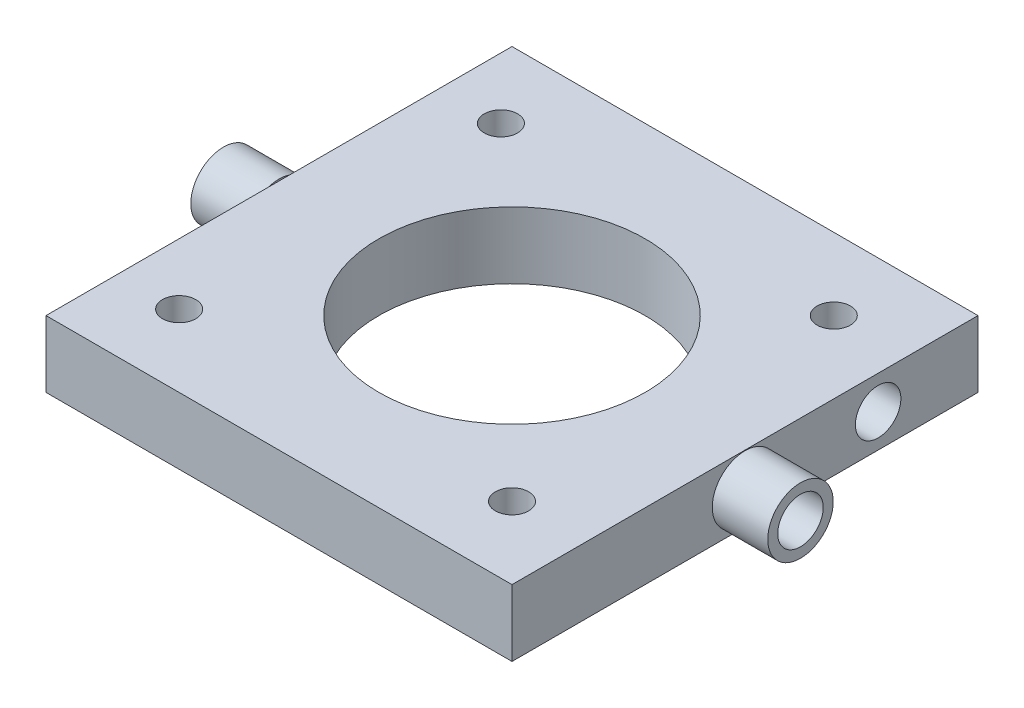
from build123d import *

# Parameters (mm, degrees)
CROQUIS1_W              = 42
CROQUIS1_H              = 42
SALIENTE_EXTRUIR1_DEPTH = 6
CROQUIS2_R              = 1.5
CROQUIS2_R_2            = 12
CORTAR_EXTRUIR2_DEPTH   = 6
CROQUIS4_R              = 2.05
CORTAR_EXTRUIR3_DEPTH   = 3
CROQUIS5_R              = 2.05
CORTAR_EXTRUIR4_DEPTH   = 3
SALIENTE_EXTRUIR2_START = 5
CROQUIS6_R              = 2.95
CROQUIS6_R_2            = 2.05
SALIENTE_EXTRUIR2_DEPTH = 5
SALIENTE_EXTRUIR3_START = 5
CROQUIS7_R              = 2.95
CROQUIS7_R_2            = 2.05
SALIENTE_EXTRUIR3_DEPTH = 5


with BuildPart() as part:
    # Croquis1 → Saliente-Extruir1 (new body)
    with BuildSketch(Plane(origin=(0, 0, 0), x_dir=(1, 0, 0), z_dir=(0, 1, 0))):
        Rectangle(CROQUIS1_W, CROQUIS1_H)
    extrude(amount=SALIENTE_EXTRUIR1_DEPTH)

    # Croquis2 → Cortar-Extruir2 (cut)
    with BuildSketch(Plane(origin=(0, 6, 0), x_dir=(1, 0, 0), z_dir=(0, 1, 0))):
        with Locations(Location((-15.5, -14.5, 0), (0, 0, 270))):
            Circle(CROQUIS2_R)
        with Locations(Location((14.5, -14.5, 0), (0, 0, 270))):
            Circle(CROQUIS2_R)
        with Locations(Location((14.5, 14.5, 0), (0, 0, 270))):
            Circle(CROQUIS2_R)
        with Locations(Location((-15.5, 14.5, 0), (0, 0, 270))):
            Circle(CROQUIS2_R)
        with Locations(Location((0, 0, 0), (0, 0, 270))):
            Circle(CROQUIS2_R_2)
    extrude(amount=-CORTAR_EXTRUIR2_DEPTH, mode=Mode.SUBTRACT)

    # Croquis4 → Cortar-Extruir3 (cut)
    with BuildSketch(Plane(origin=(21, 0, 0), x_dir=(0, 0, -1), z_dir=(1, 0, 0))):
        with Locations((12, 3)):
            Circle(CROQUIS4_R)
        with Locations((0, 3)):
            Circle(CROQUIS4_R)
    extrude(amount=-CORTAR_EXTRUIR3_DEPTH, mode=Mode.SUBTRACT)

    # Croquis5 → Cortar-Extruir4 (cut)
    with BuildSketch(Plane.ZY.offset(21)):
        with Locations((-12, 3.206908841)):
            Circle(CROQUIS5_R)
        with Locations((0, 3.206908841)):
            Circle(CROQUIS5_R)
    extrude(amount=-CORTAR_EXTRUIR4_DEPTH, mode=Mode.SUBTRACT)

    # Croquis6 → Saliente-Extruir2 (add)
    with BuildSketch(Plane(origin=(21, 0, 0), x_dir=(0, 0, -1), z_dir=(1, 0, 0)).offset(SALIENTE_EXTRUIR2_START)):
        with Locations(Location((0, 3, 0), (0, 0, 180))):
            Circle(CROQUIS6_R)
        with Locations((0, 3)):
            Circle(CROQUIS6_R_2, mode=Mode.SUBTRACT)
    extrude(amount=-SALIENTE_EXTRUIR2_DEPTH)

    # Croquis7 → Saliente-Extruir3 (add)
    with BuildSketch(Plane.ZY.offset(21).offset(SALIENTE_EXTRUIR3_START)):
        with Locations(Location((0, 3.206908841, 0), (0, 0, 108.771300902))):
            Circle(CROQUIS7_R)
        with Locations((0, 3.206908841)):
            Circle(CROQUIS7_R_2, mode=Mode.SUBTRACT)
    extrude(amount=-SALIENTE_EXTRUIR3_DEPTH)


solid = part.part
